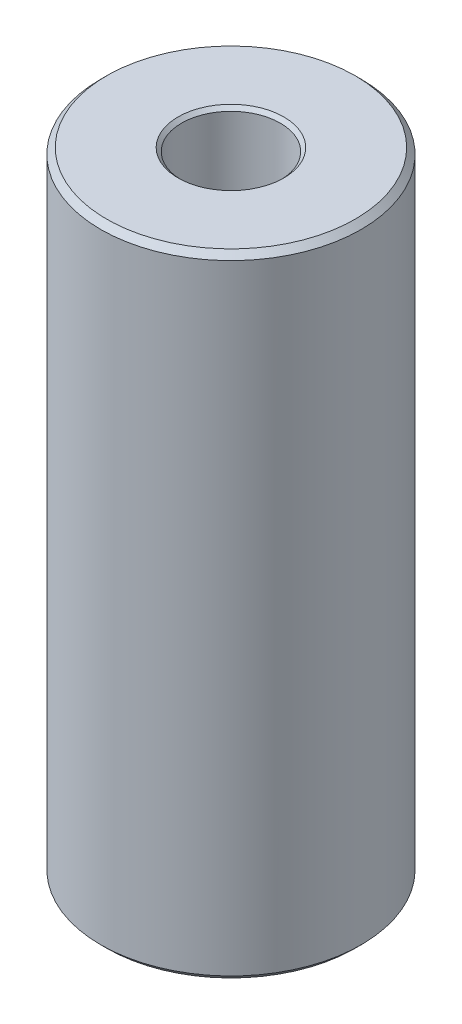
from build123d import *

# Parameters (mm, degrees)
CHAMFER1_SIZE = 0.254
CHAMFER2_SIZE = 0.1524


with BuildPart() as part:
    # Sketch1 → Revolve1 (revolve)
    with BuildSketch(Plane(origin=(0, 0, 0), x_dir=(0, 0, -1), z_dir=(1, 0, 0)), mode=Mode.PRIVATE) as revolve1_sk:
        Polygon((3.9751, 0), (5.5626, 0), (5.5626, 26.9748), (2.1082, 26.9748), (2.1082, 4.67774669), (3.9751, 3.556), align=None)
    revolve(revolve1_sk.sketch.rotate(Axis((0, -4.141094848, 0), (0, -1, 0)), 180), axis=Axis((0, -4.141094848, 0), (0, -1, 0)))

    # Chamfer1
    chamfer1_edges = [part.edges().sort_by_distance(p)[0] for p in [
        (0, 26.9748, -5.5626),
        (0, 0, -5.5626),
    ]]
    chamfer(chamfer1_edges, length=CHAMFER1_SIZE)

    # Chamfer2
    chamfer2_edges = [part.edges().sort_by_distance(p)[0] for p in [
        (0, 26.9748, -2.1082),
        (0, 0, -3.9751),
    ]]
    chamfer(chamfer2_edges, length=CHAMFER2_SIZE)


solid = part.part
